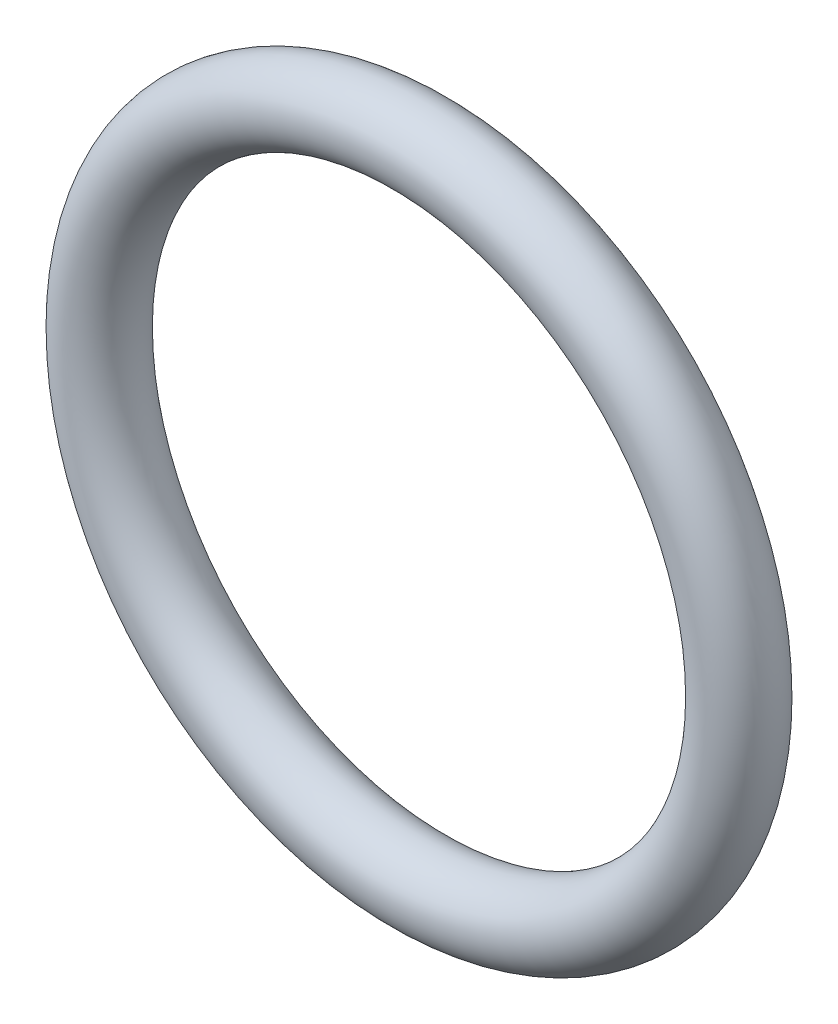
from build123d import *

# Parameters (mm, degrees)
SKETCH1_R = 1


with BuildPart() as part:
    # Sketch1 → Revolve1 (revolve)
    with BuildSketch(Plane(origin=(0, 0, 0), x_dir=(0, 0, -1), z_dir=(1, 0, 0))):
        with Locations((0, 8.5)):
            Circle(SKETCH1_R)
    revolve(axis=Axis((0, 0, 5.071393517), (0, 0, -1)))


solid = part.part
